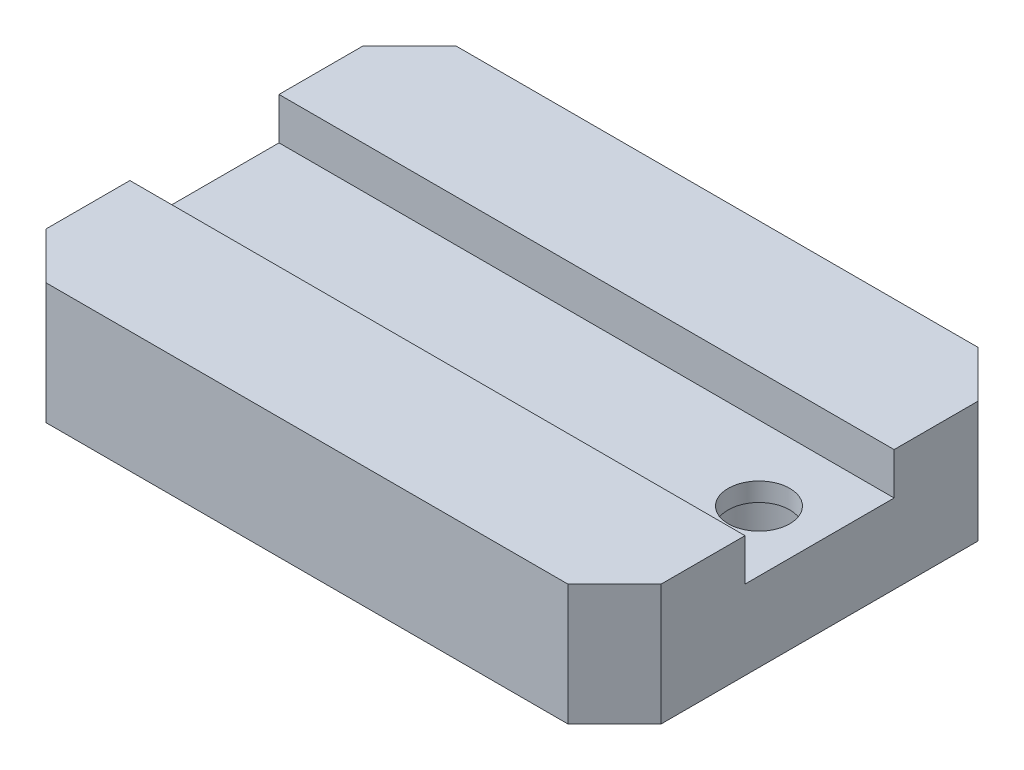
from build123d import *

# Parameters (mm, degrees)
ESBO_O1_W                = 66
ESBO_O1_H                = 13
RESSALTO_EXTRUS_O1_DEPTH = 44
ESBO_O2_W                = 66
ESBO_O2_H                = 16
CORTE_EXTRUS_O1_DEPTH    = 4.5
CHANFRO1_SIZE            = 5
ESBO_O4_R                = 3.3
CORTE_EXTRUS_O2_DEPTH    = 2
ESBO_O5_R                = 5.5
CORTE_EXTRUS_O3_DEPTH    = 6.5


with BuildPart() as part:
    # Esboço1 → Ressalto-extrusão1 (new body)
    with BuildSketch(Plane.XY):
        with Locations((33, -6.5)):
            Rectangle(ESBO_O1_W, ESBO_O1_H)
    extrude(amount=RESSALTO_EXTRUS_O1_DEPTH)

    # Esboço2 → Corte-extrusão1 (cut)
    with BuildSketch(Plane(origin=(0, 0, 0), x_dir=(1, 0, 0), z_dir=(0, 1, 0))):
        with Locations((33, -22)):
            Rectangle(ESBO_O2_W, ESBO_O2_H)
    extrude(amount=-CORTE_EXTRUS_O1_DEPTH, mode=Mode.SUBTRACT)

    # Chanfro1
    chanfro1_edges = [part.edges().sort_by_distance(p)[0] for p in [
        (66, -6.5, 44),
        (0, -6.5, 44),
        (66, -6.5, 0),
        (0, -6.5, 0),
    ]]
    chamfer(chanfro1_edges, length=CHANFRO1_SIZE)

    # Esboço4 → Corte-extrusão2 (cut)
    with BuildSketch(Plane(origin=(0, -4.5, 0), x_dir=(1, 0, 0), z_dir=(0, 1, 0))):
        with Locations(Location((59.5, -22, 0), (0, 0, 270))):
            Circle(ESBO_O4_R)
    extrude(amount=-CORTE_EXTRUS_O2_DEPTH, mode=Mode.SUBTRACT)

    # Esboço5 → Corte-extrusão3 (cut)
    with BuildSketch(Plane.XZ.offset(13)):
        with Locations(Location((59.5, 22, 0), (0, 0, 270))):
            Circle(ESBO_O5_R)
    extrude(amount=-CORTE_EXTRUS_O3_DEPTH, mode=Mode.SUBTRACT)


solid = part.part
